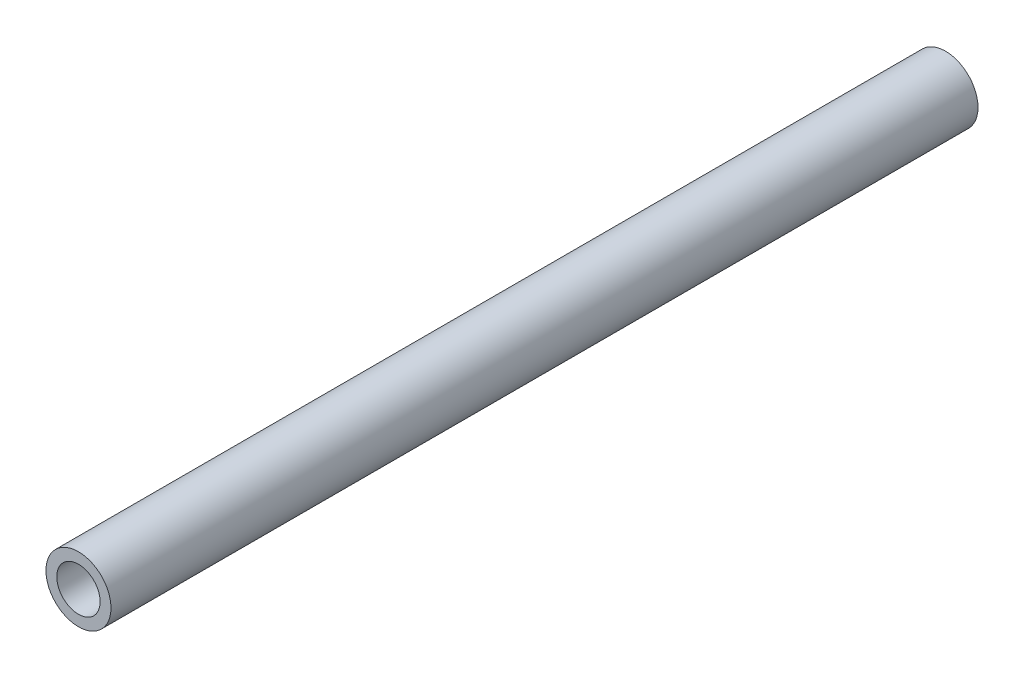
from build123d import *

# Parameters (mm, degrees)
SKETCH_1_R      = 7.5
SKETCH_1_R_2    = 5
EXTRUDE_1_DEPTH = 200


with BuildPart() as part:
    # 草图1 → 凸台-拉伸1 (new body)
    with BuildSketch(Plane.XY):
        Circle(SKETCH_1_R)
        Circle(SKETCH_1_R_2, mode=Mode.SUBTRACT)
    extrude(amount=EXTRUDE_1_DEPTH)


solid = part.part
